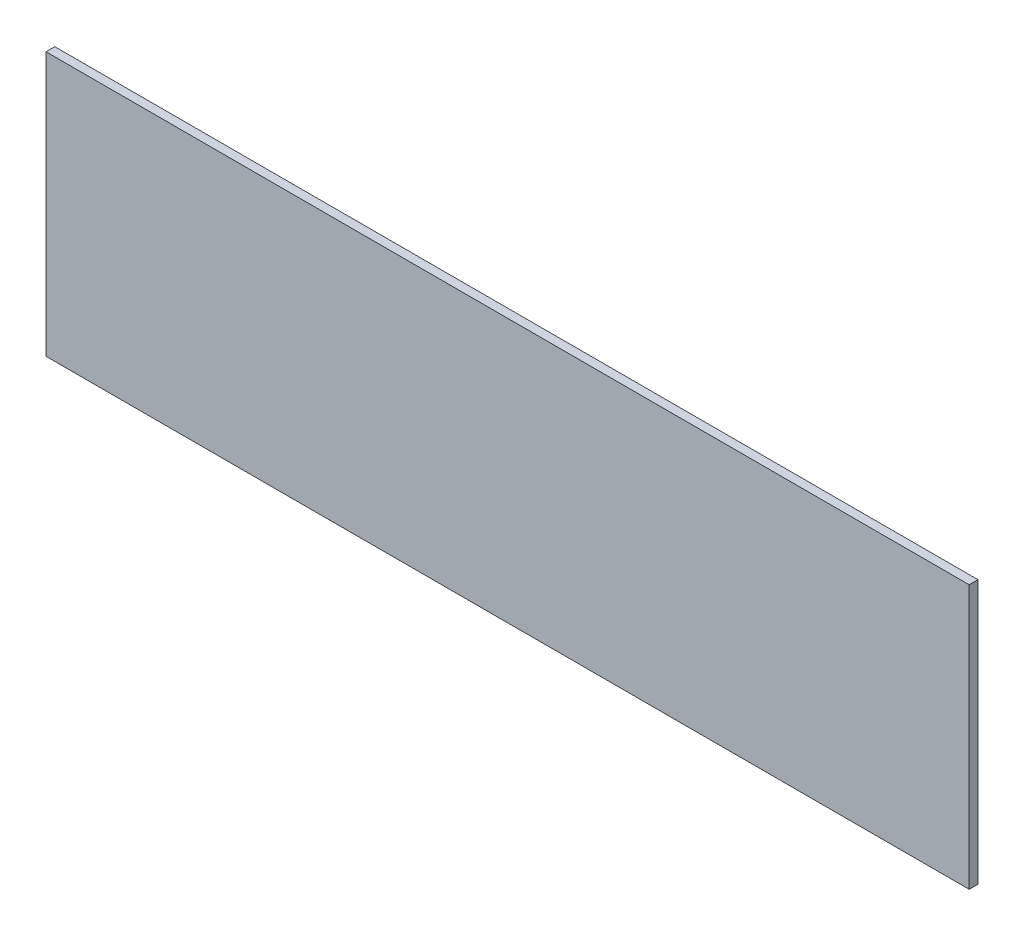
from build123d import *

# Parameters (mm, degrees)
SKETCH1_W           = 105
SKETCH1_H           = 30
BOSS_EXTRUDE1_DEPTH = 1


with BuildPart() as part:
    # Sketch1 → Boss-Extrude1 (new body)
    with BuildSketch(Plane.XY):
        Rectangle(SKETCH1_W, SKETCH1_H)
    extrude(amount=BOSS_EXTRUDE1_DEPTH)


solid = part.part
